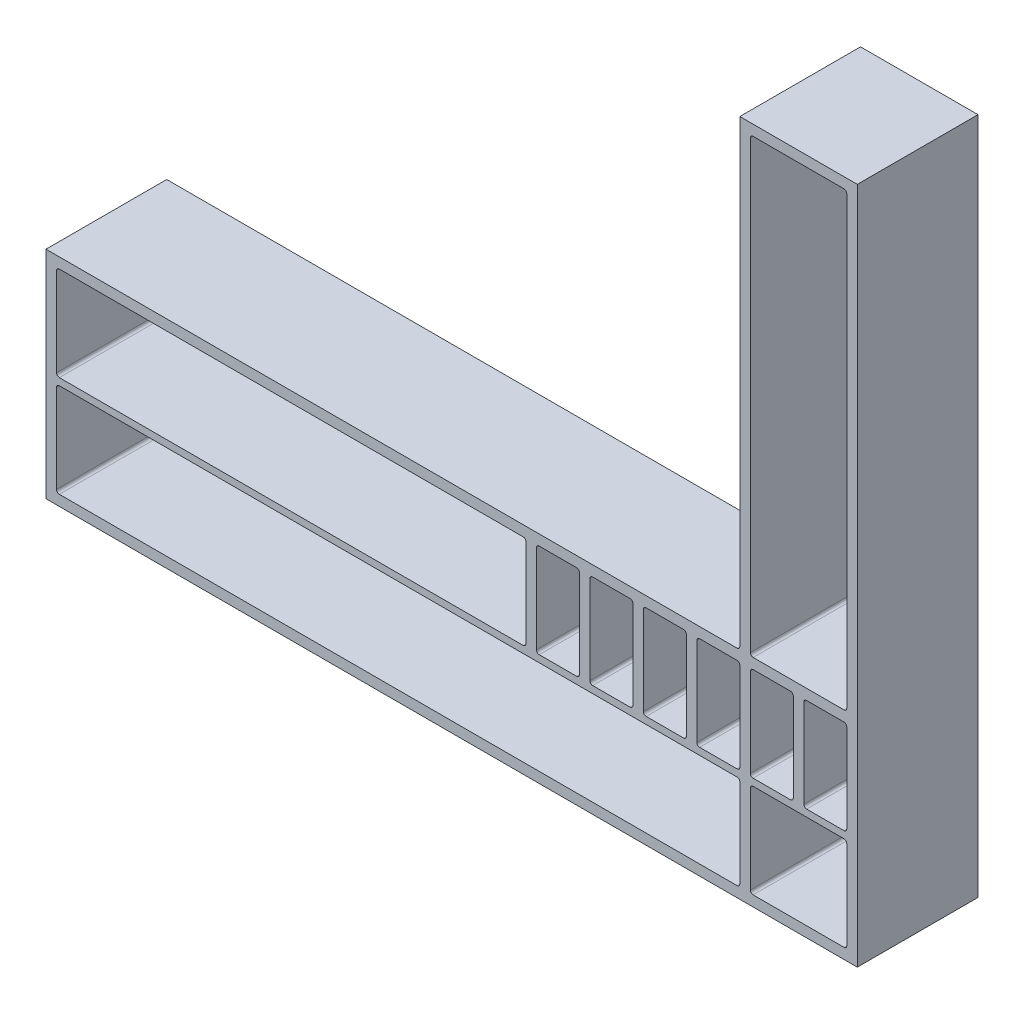
from build123d import *

# Parameters (mm, degrees)
SKETCH1_W           = 2890
SKETCH1_H           = 430
BOSS_EXTRUDE1_DEPTH = 770
SKETCH2_W           = 2815
SKETCH2_H           = 695
CUT_EXTRUDE1_DEPTH  = 397.5
SKETCH3_W           = 2815
SKETCH3_H           = 25
BOSS_EXTRUDE2_DEPTH = 397.5
SKETCH5_W           = 37.5
SKETCH5_H           = 335
BOSS_EXTRUDE3_DEPTH = 397.5
FILLET2_R           = 10
SKETCH7_W           = 37.5
SKETCH7_H           = 335
BOSS_EXTRUDE4_DEPTH = 397.5
FILLET3_R           = 10
BOSS_EXTRUDE5_DEPTH = 1645
SKETCH10_W          = 343.5
SKETCH10_H          = 392.5
BOSS_EXTRUDE6_DEPTH = 37.5
FILLET4_R           = 10


with BuildPart() as part:
    # Sketch1 → Boss-Extrude1 (new body)
    with BuildSketch(Plane(origin=(0, 0, 0), x_dir=(1, 0, 0), z_dir=(0, 1, 0))):
        Rectangle(SKETCH1_W, SKETCH1_H)
    extrude(amount=BOSS_EXTRUDE1_DEPTH)

    # Sketch2 → Cut-Extrude1 (cut)
    with BuildSketch(Plane.XY.offset(215)):
        with Locations((0, 385)):
            Rectangle(SKETCH2_W, SKETCH2_H)
    extrude(amount=-CUT_EXTRUDE1_DEPTH, mode=Mode.SUBTRACT)

    # Sketch3 → Boss-Extrude2 (add)
    with BuildSketch(Plane.XY.offset(-182.5)):
        with Locations((0, 385)):
            Rectangle(SKETCH3_W, SKETCH3_H)
    extrude(amount=BOSS_EXTRUDE2_DEPTH)

    # Sketch5 → Boss-Extrude3 (add)
    with BuildSketch(Plane.XY.offset(-182.5)):
        with Locations((283.25, 565)):
            Rectangle(SKETCH5_W, SKETCH5_H)
        with Locations((473.75, 565)):
            Rectangle(SKETCH5_W, SKETCH5_H)
        with Locations((664.25, 565)):
            Rectangle(SKETCH5_W, SKETCH5_H)
        with Locations((854.75, 565)):
            Rectangle(SKETCH5_W, SKETCH5_H)
        with Locations((1045.25, 565)):
            Rectangle(SKETCH5_W, SKETCH5_H)
        with Locations((1235.75, 565)):
            Rectangle(SKETCH5_W, SKETCH5_H)
    extrude(amount=BOSS_EXTRUDE3_DEPTH)

    # Fillet2
    fillet2_edges = [part.edges().sort_by_distance(p)[0] for p in [
        (1407.5, 565, -182.5),
        (1331, 397.5, -182.5),
        (1254.5, 565, -182.5),
        (1331, 732.5, -182.5),
        (1217, 565, -182.5),
        (1140.5, 397.5, -182.5),
        (1064, 565, -182.5),
        (1140.5, 732.5, -182.5),
        (1407.5, 732.5, 16.25),
        (1254.5, 732.5, 16.25),
        (1254.5, 397.5, 16.25),
        (1407.5, 397.5, 16.25),
        (1217, 397.5, 16.25),
        (1064, 397.5, 16.25),
        (1064, 732.5, 16.25),
        (1217, 732.5, 16.25),
        (1026.5, 732.5, 16.25),
        (1026.5, 397.5, 16.25),
        (1026.5, 565, -182.5),
        (950, 732.5, -182.5),
        (873.5, 732.5, 16.25),
        (950, 397.5, -182.5),
        (873.5, 565, -182.5),
        (873.5, 397.5, 16.25),
        (683, 397.5, 16.25),
        (836, 397.5, 16.25),
        (836, 732.5, 16.25),
        (836, 565, -182.5),
        (683, 565, -182.5),
        (759.5, 732.5, -182.5),
        (683, 732.5, 16.25),
        (645.5, 732.5, 16.25),
        (492.5, 732.5, 16.25),
        (492.5, 397.5, 16.25),
        (645.5, 397.5, 16.25),
        (645.5, 565, -182.5),
        (569, 732.5, -182.5),
        (492.5, 565, -182.5),
        (569, 397.5, -182.5),
        (455, 565, -182.5),
        (378.5, 397.5, -182.5),
        (302, 565, -182.5),
        (378.5, 732.5, -182.5),
        (302, 397.5, 16.25),
        (455, 397.5, 16.25),
        (455, 732.5, 16.25),
        (302, 732.5, 16.25),
    ]]
    fillet(fillet2_edges, radius=FILLET2_R)

    # Sketch7 → Boss-Extrude4 (add)
    with BuildSketch(Plane.XY.offset(-182.5)):
        with Locations((1045.25, 205)):
            Rectangle(SKETCH7_W, SKETCH7_H)
    extrude(amount=BOSS_EXTRUDE4_DEPTH)

    # Fillet3
    fillet3_edges = [part.edges().sort_by_distance(p)[0] for p in [
        (1407.5, 205, -182.5),
        (1407.5, 37.5, 16.25),
        (1407.5, 372.5, 16.25),
        (1235.75, 372.5, -182.5),
        (1235.75, 37.5, -182.5),
        (1064, 205, -182.5),
        (1064, 37.5, 16.25),
        (1064, 372.5, 16.25),
    ]]
    fillet(fillet3_edges, radius=FILLET3_R)

    # Sketch9 → Boss-Extrude5 (add)
    with BuildSketch(Plane(origin=(0, 770, 0), x_dir=(1, 0, 0), z_dir=(0, 1, 0))):
        Polygon((1407.5, 215), (1026.5, 215), (1026.5, -215), (1064, -215), (1064, -177.5), (1064, 177.5), (1407.5, 177.5), (1407.5, -177.5), (1407.5, -215), (1445, -215), (1445, 215), align=None)
    extrude(amount=BOSS_EXTRUDE5_DEPTH)

    # Sketch10 → Boss-Extrude6 (add)
    with BuildSketch(Plane(origin=(0, 2415, 0), x_dir=(1, 0, 0), z_dir=(0, 1, 0))):
        with Locations((1235.75, -18.75)):
            Rectangle(SKETCH10_W, SKETCH10_H)
    extrude(amount=-BOSS_EXTRUDE6_DEPTH)

    # Fillet4
    fillet4_edges = [part.edges().sort_by_distance(p)[0] for p in [
        (-190.5, 37.5, -182.5),
        (-1407.5, 565, -182.5),
        (-1407.5, 37.5, 16.25),
        (-1407.5, 732.5, 16.25),
        (-1407.5, 205, -182.5),
        (-1407.5, 397.5, 16.25),
        (-190.5, 372.5, -182.5),
        (-1407.5, 372.5, 16.25),
        (1026.5, 205, -182.5),
        (1026.5, 372.5, 16.25),
        (1026.5, 37.5, 16.25),
        (1407.5, 770, 18.75),
        (1026.5, 770, 0),
        (1235.75, 770, -177.5),
        (1064, 770, 18.75),
        (1407.5, 1573.75, -177.5),
        (1064, 1573.75, -177.5),
        (1064, 2377.5, 18.75),
        (1235.75, 2377.5, -177.5),
        (1407.5, 2377.5, 18.75),
        (-571.5, 397.5, -182.5),
        (-571.5, 732.5, -182.5),
        (264.5, 732.5, 16.25),
        (264.5, 397.5, 16.25),
        (264.5, 565, -182.5),
    ]]
    fillet(fillet4_edges, radius=FILLET4_R)


solid = part.part
